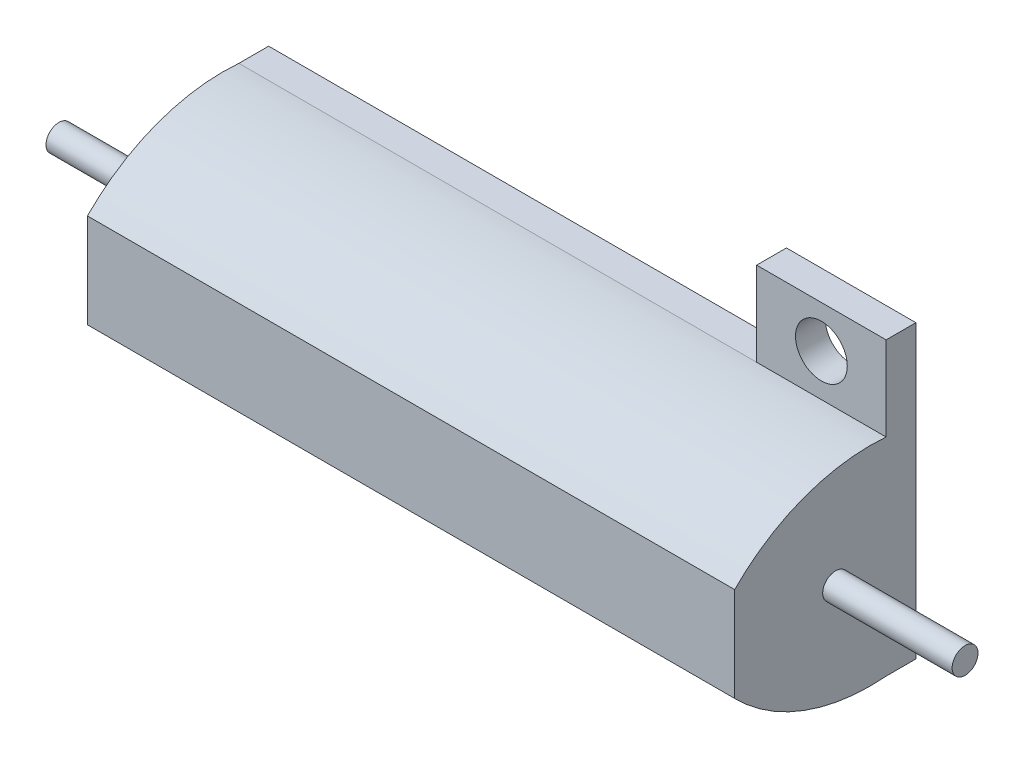
from build123d import *

# Parameters (mm, degrees)
SKETCH_1_W           = 50
SKETCH_1_H           = 16
EXTRUDE_1_DEPTH      = 2.3
SKETCH_2_W           = 10
SKETCH_2_H           = 6.5
SKETCH_2_R           = 2
EXTRUDE_2_DEPTH      = 2.3
EXTRUDE_3_REACH      = 54.111
EXTRUDE_4_DEPTH      = 35
EXTRUDE_4_DEPTH_BACK = 35
SKETCH_5_R           = 1


with BuildPart() as part:
    # 草图1 → 拉伸1 (new body)
    with BuildSketch(Plane.XY):
        Rectangle(SKETCH_1_W, SKETCH_1_H)
    extrude(amount=EXTRUDE_1_DEPTH)

    # 草图2 → 拉伸2 (add)
    # profile 1 of 2: a face of its own
    with BuildSketch(Plane(origin=(0, 0, 0), x_dir=(-1, 0, 0), z_dir=(0, 0, -1))):
        with Locations((20, -11.25)):
            Rectangle(SKETCH_2_W, SKETCH_2_H)
        with Locations((20, -11.25)):
            Circle(SKETCH_2_R, mode=Mode.SUBTRACT)
    # profile 2 of 2: a face of its own
    with BuildSketch(Plane(origin=(0, 0, 0), x_dir=(-1, 0, 0), z_dir=(0, 0, -1))):
        with Locations((-20, 11.25)):
            Rectangle(SKETCH_2_W, SKETCH_2_H)
        with Locations((-20, 11.25)):
            Circle(SKETCH_2_R, mode=Mode.SUBTRACT)
    extrude(amount=-EXTRUDE_2_DEPTH)

    # 拉伸3: up to this face of the body (flat: up to its plane)
    extrude_3_end = Plane(part.part.faces().sort_by_distance((-25, -3.25, 1.15))[0])
    # 草图4 → 拉伸3 (add, up to the picked face)
    with BuildSketch(Plane(origin=(25, 0, 0), x_dir=(0, 0, -1), z_dir=(1, 0, 0)), mode=Mode.PRIVATE) as extrude_3_sk1:
        with BuildLine():
            Line((-2.3, -8), (-2.3, 8))
            ThreePointArc((-2.3, 8), (-8.636680234, 7.127476149), (-14, 3.641846314))
            Line((-14, 3.641846314), (-14, -3.641846314))
            ThreePointArc((-14, -3.641846314), (-8.636680234, -7.127476149), (-2.3, -8))
        make_face()
    extrude_3_tool1 = split(extrude(extrude_3_sk1.sketch, amount=-EXTRUDE_3_REACH, mode=Mode.PRIVATE), bisect_by=extrude_3_end, keep=Keep.BOTH, mode=Mode.PRIVATE)
    add(extrude_3_tool1.solids().sort_by(Axis((25, 0, 7.555893), (-1, 0, 0)))[0])

    # 草图5 → 拉伸4 (add, two sides: drawn at the far end of the back side and taken through both)
    with BuildSketch(Plane(origin=(0, 0, 0), x_dir=(0, 0, -1), z_dir=(1, 0, 0)).offset(-EXTRUDE_4_DEPTH_BACK)):
        with Locations(Location((-6.2, 0, 0), (0, 0, 180))):
            Circle(SKETCH_5_R)
    extrude(amount=EXTRUDE_4_DEPTH + EXTRUDE_4_DEPTH_BACK)


solid = part.part
